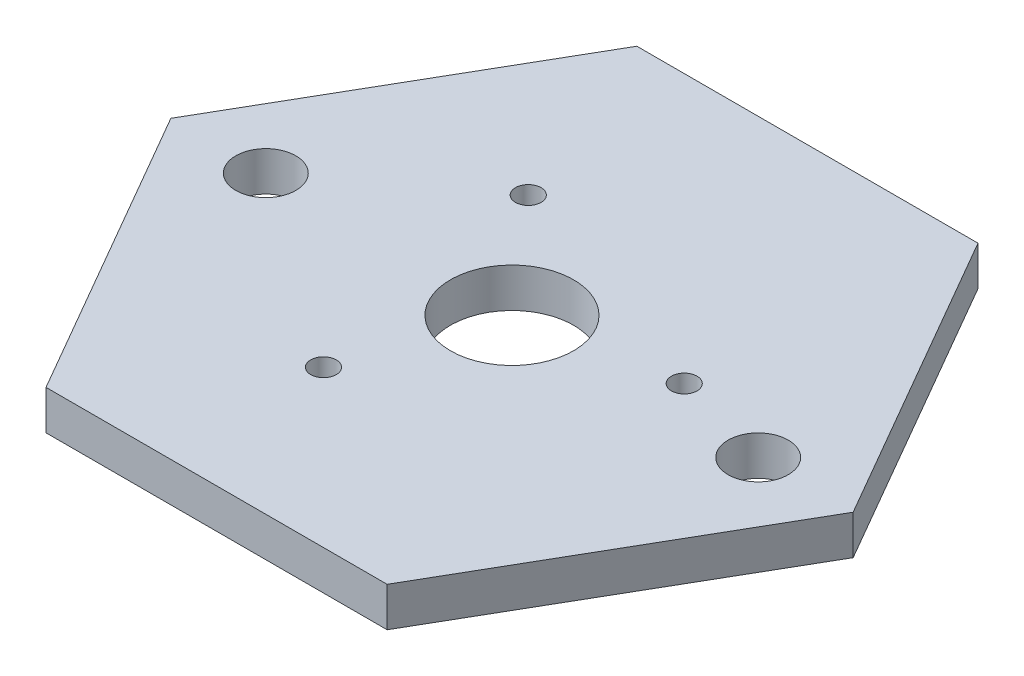
from build123d import *

# Parameters (mm, degrees)
EXTRUDE_1_DEPTH     = 8
SKETCH_2_R          = 6.1
CUT_EXTRUDE_1_DEPTH = 93
SKETCH_4_R          = 12.5
CUT_EXTRUDE_3_DEPTH = 93
SKETCH_5_R          = 2.6
CUT_EXTRUDE_4_DEPTH = 93
SKETCH_6_R          = 5.5
CUT_EXTRUDE_5_DEPTH = 1.5


with BuildPart() as part:
    # 草图1 → 凸台-拉伸1 (new body)
    with BuildSketch(Plane(origin=(0, 0, 0), x_dir=(1, 0, 0), z_dir=(0, 1, 0))):
        Polygon((69.282032303, 0), (34.641016151, 60), (-34.641016151, 60), (-69.282032303, 0), (-34.641016151, -60), (34.641016151, -60), align=None)
    extrude(amount=EXTRUDE_1_DEPTH)

    # 草图2 → 切除-拉伸1 (cut, through all)
    with BuildSketch(Plane(origin=(0, 8, 0), x_dir=(1, 0, 0), z_dir=(0, 1, 0))):
        with Locations(Location((-50, 0, 0), (0, 0, 270))):
            Circle(SKETCH_2_R)
        with Locations(Location((50, 0, 0), (0, 0, 270))):
            Circle(SKETCH_2_R)
    extrude(amount=-CUT_EXTRUDE_1_DEPTH, mode=Mode.SUBTRACT)

    # 草图4 → 切除-拉伸3 (cut, through all)
    with BuildSketch(Plane(origin=(0, 8, 0), x_dir=(1, 0, 0), z_dir=(0, 1, 0))):
        with Locations(Location((0, 0, 0), (0, 0, 270))):
            Circle(SKETCH_4_R)
    extrude(amount=-CUT_EXTRUDE_3_DEPTH, mode=Mode.SUBTRACT)

    # 草图5 → 切除-拉伸4 (cut, through all)
    with BuildSketch(Plane(origin=(0, 8, 0), x_dir=(1, 0, 0), z_dir=(0, 1, 0))):
        with Locations(Location((-10, -28.284271247, 0), (0, 0, 270))):
            Circle(SKETCH_5_R)
        with Locations(Location((-19.494897428, 22.802389662, 0), (0, 0, 270))):
            Circle(SKETCH_5_R)
        with Locations(Location((29.494897428, 5.481881586, 0), (0, 0, 270))):
            Circle(SKETCH_5_R)
    extrude(amount=-CUT_EXTRUDE_4_DEPTH, mode=Mode.SUBTRACT)

    # 草图6 → 切除-拉伸5 (cut)
    with BuildSketch(Plane.XZ):
        with Locations(Location((-10, 28.284271247, 0), (0, 0, 270))):
            Circle(SKETCH_6_R)
        with Locations(Location((-19.494897428, -22.802389662, 0), (0, 0, 270))):
            Circle(SKETCH_6_R)
        with Locations(Location((29.494897428, -5.481881586, 0), (0, 0, 270))):
            Circle(SKETCH_6_R)
    extrude(amount=-CUT_EXTRUDE_5_DEPTH, mode=Mode.SUBTRACT)


solid = part.part
